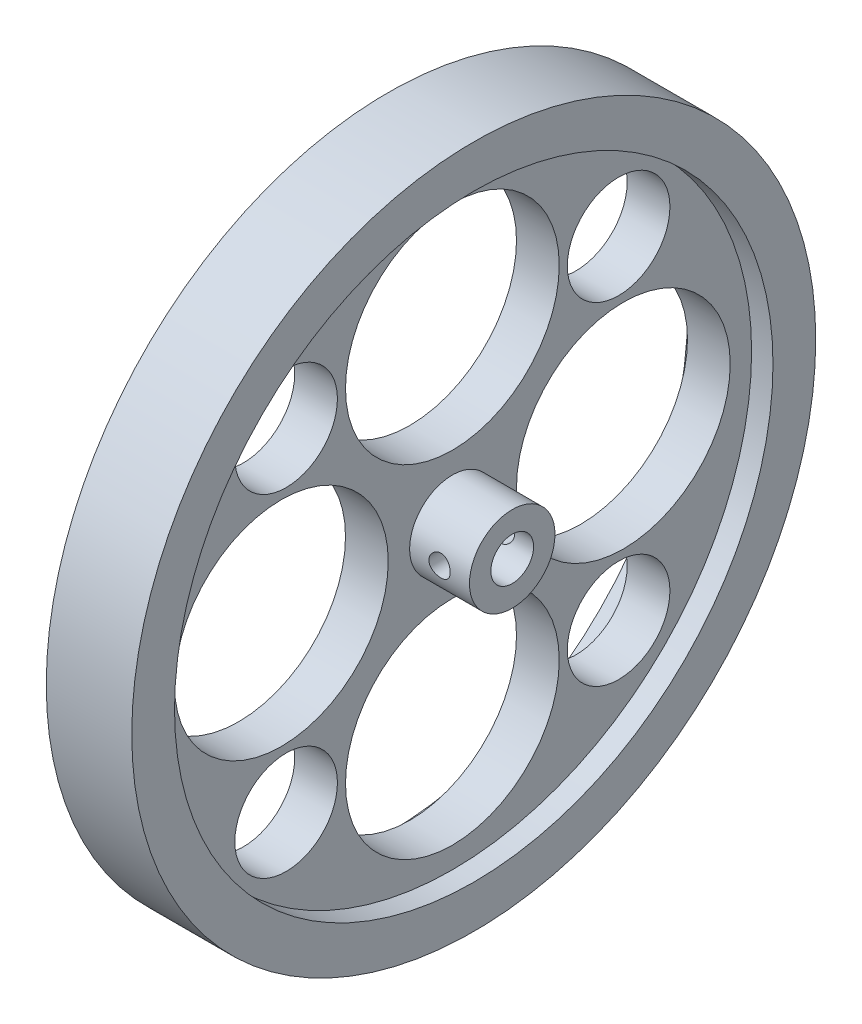
from build123d import *

# Parameters (mm, degrees)
SKETCH1_R           = 5
SKETCH1_R_2         = 2.5
BOSS_EXTRUDE1_DEPTH = 7.25
SKETCH5_R           = 12.5
SKETCH5_R_2         = 6
CUT_EXTRUDE1_DEPTH  = 58.063561053
CIRPATTERN1_COUNT   = 4
SKETCH6_R           = 1.25
CUT_EXTRUDE2_DEPTH  = 10


with BuildPart() as part:
    # Sketch1 → Boss-Extrude1 (new, symmetric)
    with BuildSketch(Plane(origin=(0, 0, 0), x_dir=(0, 0, -1), z_dir=(1, 0, 0))):
        with Locations(Location((0, 0, 0), (0, 0, 180))):
            Circle(SKETCH1_R)
        with Locations(Location((0, 0, 0), (0, 0, 180))):
            Circle(SKETCH1_R_2, mode=Mode.SUBTRACT)
    extrude(amount=BOSS_EXTRUDE1_DEPTH, both=True)

    # Sketch4 → Revolve4 (revolve)
    with BuildSketch(Plane.XY, mode=Mode.PRIVATE) as revolve4_sk:
        Polygon((-4.75, 5), (-4.75, 35), (-7.25, 35), (-7.25, 40), (2.75, 40), (2.75, 35), (0.25, 35), (0.25, 5), align=None)
    revolve(revolve4_sk.sketch.rotate(Axis((0, 0, 0), (-1, 0, 0)), 90), axis=Axis((0, 0, 0), (-1, 0, 0)))

    # Sketch5 → Cut-Extrude1 (cut, symmetric)
    with BuildSketch(Plane(origin=(0.25, 0, 0), x_dir=(0, 0, -1), z_dir=(1, 0, 0))):
        with Locations((0, 20)):
            Circle(SKETCH5_R)
        with Locations((-19.445436483, 19.445436483)):
            Circle(SKETCH5_R_2)
    cut_extrude1 = extrude(amount=CUT_EXTRUDE1_DEPTH, both=True, mode=Mode.SUBTRACT)

    # CirPattern1: Cut-Extrude1 ×4 about axis
    cirpattern1_axis = Axis((0, 0, 0), (1, 0, 0))
    for i in range(1, CIRPATTERN1_COUNT):
        add(cut_extrude1.rotate(cirpattern1_axis, i * 360 / CIRPATTERN1_COUNT), mode=Mode.SUBTRACT)

    # Sketch6 → Cut-Extrude2 (cut, symmetric)
    with BuildSketch(Plane.XY):
        with Locations((3.75, 0)):
            Circle(SKETCH6_R)
    extrude(amount=CUT_EXTRUDE2_DEPTH, both=True, mode=Mode.SUBTRACT)


solid = part.part
